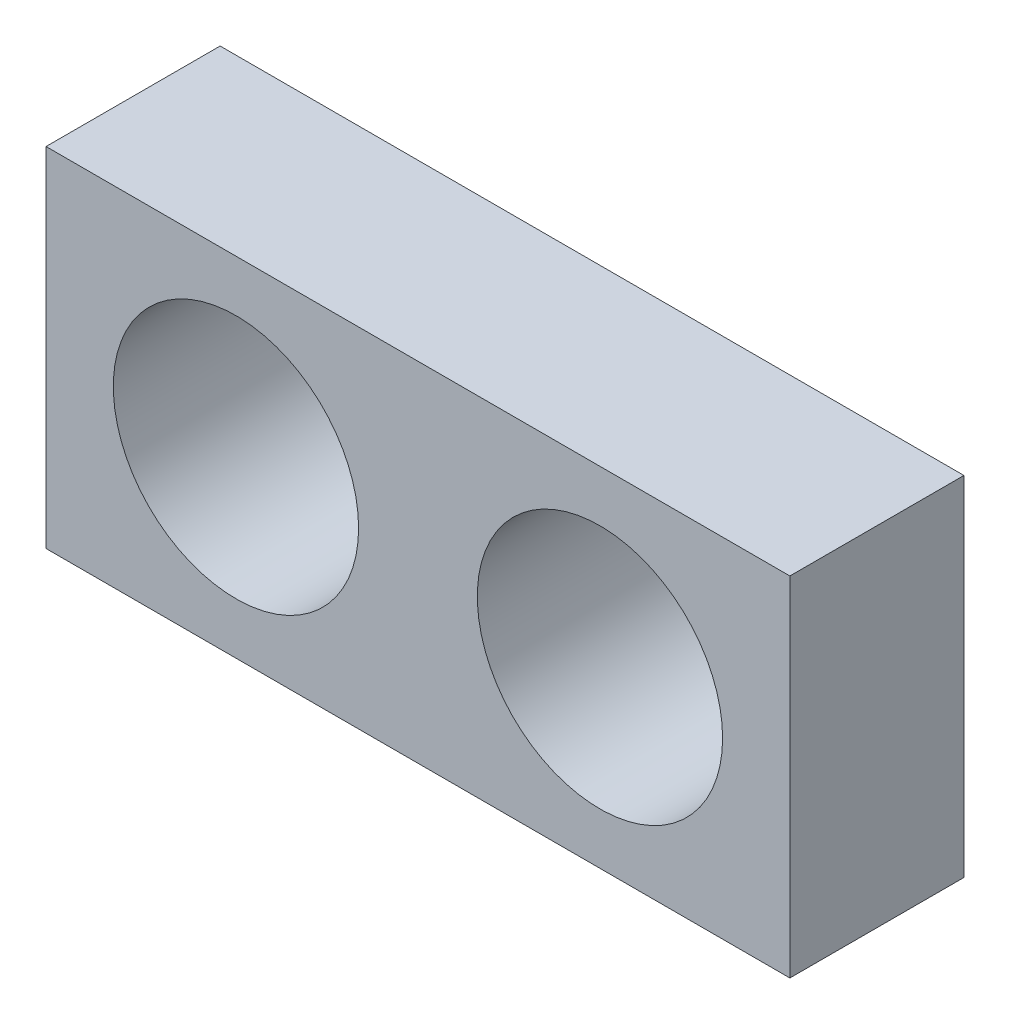
from build123d import *

# Parameters (mm, degrees)
SKETCH2_W           = 47
SKETCH2_H           = 22
BOSS_EXTRUDE1_DEPTH = 11
SKETCH3_R           = 7.75
CUT_EXTRUDE1_DEPTH  = 11


with BuildPart() as part:
    # Sketch2 → Boss-Extrude1 (new body)
    with BuildSketch(Plane.XY):
        Rectangle(SKETCH2_W, SKETCH2_H)
    extrude(amount=BOSS_EXTRUDE1_DEPTH)

    # Sketch3 → Cut-Extrude1 (cut)
    with BuildSketch(Plane.XY.offset(11)):
        with Locations((-11.5, 0)):
            Circle(SKETCH3_R)
        with Locations((11.5, 0)):
            Circle(SKETCH3_R)
    extrude(amount=-CUT_EXTRUDE1_DEPTH, mode=Mode.SUBTRACT)


solid = part.part
